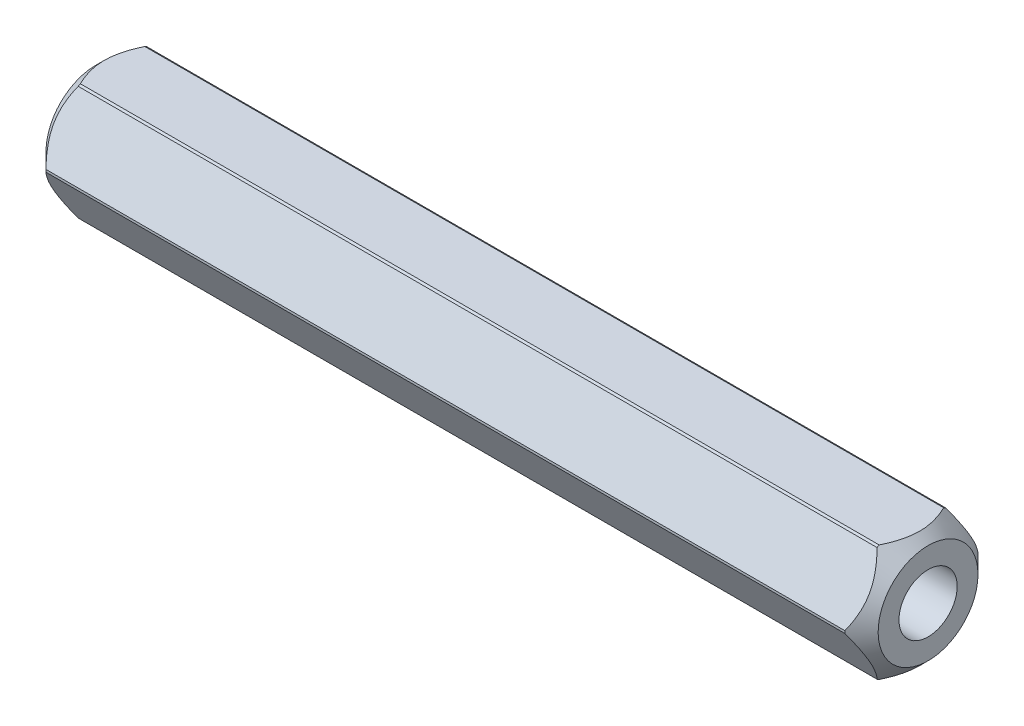
from build123d import *

# Parameters (mm, degrees)
EXTRUDE_310_DEPTH          = 25
CUT_EXTRUDE_411_DEPTH      = 26.565275929
CUT_EXTRUDE_411_DEPTH_BACK = 26.565275929
SKETCH_8_R                 = 5
SKETCH_8_R_2               = 4
CUT_EXTRUDE_606_DEPTH      = 26.558755838
CUT_EXTRUDE_606_DEPTH_BACK = 26.558755838
SKETCH_9_R                 = 1.75


with BuildPart() as part:
    # 草图1 → Extrude 310 (new, symmetric)
    with BuildSketch(Plane(origin=(0, 0, 0), x_dir=(0, 0, -1), z_dir=(1, 0, 0))):
        Polygon((4.041451884, 0), (2.020725942, 3.5), (-2.020725942, 3.5), (-4.041451884, 0), (-2.020725942, -3.5), (2.020725942, -3.5), align=None)
    extrude(amount=EXTRUDE_310_DEPTH, both=True)

    # 草图8 → Cut-Extrude 411 (cut, two sides: drawn at the far end of the back side and taken through both)
    with BuildSketch(Plane(origin=(0, 0, 0), x_dir=(0, 0, -1), z_dir=(1, 0, 0)).offset(-CUT_EXTRUDE_411_DEPTH_BACK)):
        Circle(SKETCH_8_R)
        Circle(SKETCH_8_R_2, mode=Mode.SUBTRACT)
    extrude(amount=CUT_EXTRUDE_411_DEPTH + CUT_EXTRUDE_411_DEPTH_BACK, mode=Mode.SUBTRACT)

    # 草图9 → Cut-Extrude 606 (cut, two sides: drawn at the far end of the back side and taken through both)
    with BuildSketch(Plane(origin=(0, 0, 0), x_dir=(0, 0, -1), z_dir=(1, 0, 0)).offset(-CUT_EXTRUDE_606_DEPTH_BACK)):
        Circle(SKETCH_9_R)
    extrude(amount=CUT_EXTRUDE_606_DEPTH + CUT_EXTRUDE_606_DEPTH_BACK, mode=Mode.SUBTRACT)

    # 草图10 → Cut-Revolve 900 (revolve, cut)
    with BuildSketch(Plane.XY, mode=Mode.PRIVATE) as cut_revolve_900_sk:
        Polygon((-25.5, 4), (-24, 4), (-25.5, 2.5), align=None)
        Polygon((24, 4), (25.5, 2.5), (25.5, 4), align=None)
    revolve(cut_revolve_900_sk.sketch.rotate(Axis((25, 0, 0), (-1, 0, 0)), 268.955024372), axis=Axis((25, 0, 0), (-1, 0, 0)), mode=Mode.SUBTRACT)


solid = part.part
